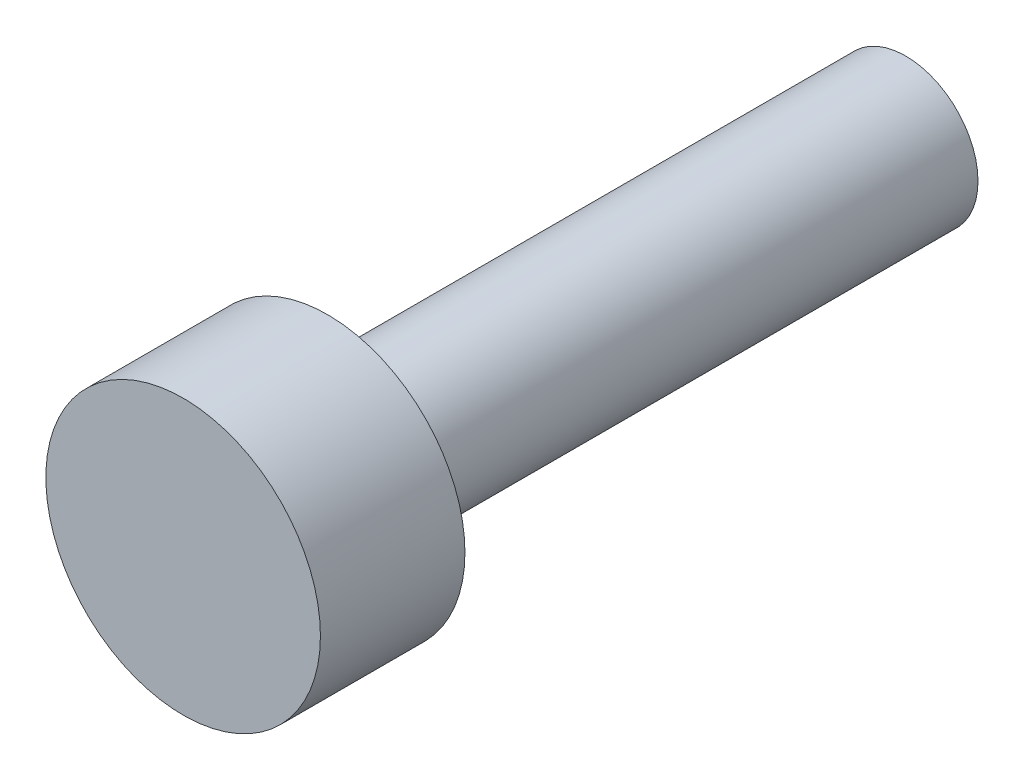
from build123d import *

# Parameters (mm, degrees)
SHANK_NOMINAL_THREAD_ENVELOPE_START     = -8
SHANK_NOMINAL_THREAD_ENVELOPE_PROFILE_R = 1
SHANK_NOMINAL_THREAD_ENVELOPE_DEPTH     = 8
SOCKET_HEAD_ENVELOPE_PROFILE_R          = 1.9
SOCKET_HEAD_ENVELOPE_DEPTH              = 2


with BuildPart() as part:
    # Shank_nominal_thread_envelope_profile → Shank_nominal_thread_envelope (new body)
    with BuildSketch(Plane.XY.offset(SHANK_NOMINAL_THREAD_ENVELOPE_START)):
        Circle(SHANK_NOMINAL_THREAD_ENVELOPE_PROFILE_R)
    extrude(amount=SHANK_NOMINAL_THREAD_ENVELOPE_DEPTH)

    # Socket_head_envelope_profile → Socket_head_envelope (add)
    with BuildSketch(Plane.XY):
        Circle(SOCKET_HEAD_ENVELOPE_PROFILE_R)
    extrude(amount=SOCKET_HEAD_ENVELOPE_DEPTH)


solid = part.part
